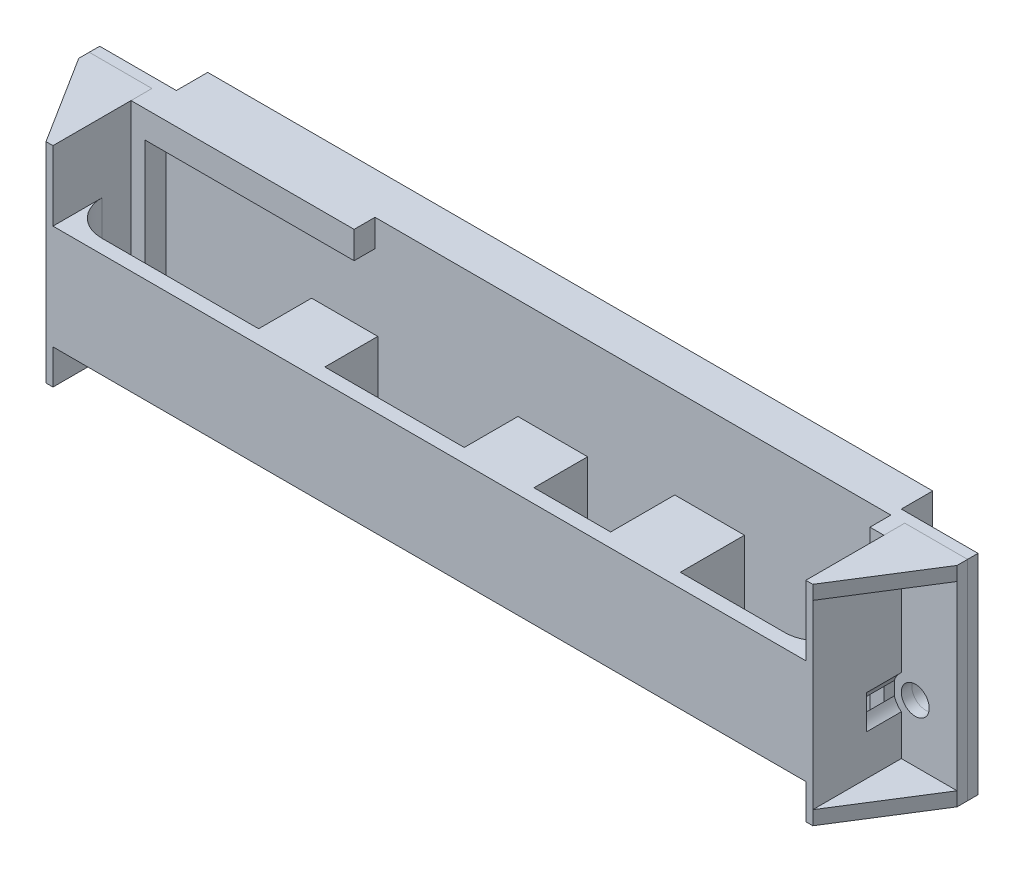
from build123d import *

# Parameters (mm, degrees)
SKETCH1_W             = 30
SKETCH1_H             = 104
BOSS_EXTRUDE1_DEPTH   = 6
BOSS_EXTRUDE2_START   = -6
SKETCH2_W             = 11
SKETCH2_H             = 30
SKETCH2_R             = 2
BOSS_EXTRUDE2_DEPTH   = 1.5
SKETCH4_W             = 2
SKETCH4_H             = 30
BOSS_EXTRUDE5_DEPTH   = 3
SKETCH4_3_W           = 9
SKETCH4_3_H           = 30
SKETCH4_3_R           = 2
BOSS_EXTRUDE6_DEPTH   = 1.5
BOSS_EXTRUDE6_2_DEPTH = 1.5
BOSS_EXTRUDE7_DEPTH   = 2
BOSS_EXTRUDE8_START   = -30
BOSS_EXTRUDE8_DEPTH   = 2
BOSS_EXTRUDE9_REACH   = 74.643
SKETCH5_4_W           = 1
SKETCH5_4_H           = 12.7
BOSS_EXTRUDE10_START  = -5
SKETCH5_5_W           = 9.5
SKETCH5_5_H           = 7.6
SKETCH5_5_W_2         = 10
SKETCH5_5_H_2         = 7.7
SKETCH5_5_H_3         = 9.2
BOSS_EXTRUDE10_DEPTH  = 15
FILLET1_R             = 5
SKETCH6_R             = 3.15
CUT_EXTRUDE3_DEPTH    = 5


with BuildPart() as part:
    # Sketch1 → Boss-Extrude1 (new body)
    with BuildSketch(Plane(origin=(0, 0, 0), x_dir=(0, 1, 0), z_dir=(0, 0, 1))):
        Rectangle(SKETCH1_W, SKETCH1_H)
    extrude(amount=BOSS_EXTRUDE1_DEPTH)

    # Sketch2 → Boss-Extrude2 (add)
    # profile 1 of 2: a face of its own
    with BuildSketch(Plane(origin=(0, 0, 0), x_dir=(1, 0, 0), z_dir=(0, 0, -1)).offset(BOSS_EXTRUDE2_START)):
        with Locations((-57.5, 0)):
            Rectangle(SKETCH2_W, SKETCH2_H)
        with Locations((-57.5, -4.75)):
            Circle(SKETCH2_R, mode=Mode.SUBTRACT)
    # profile 2 of 2: a face of its own
    with BuildSketch(Plane(origin=(0, 0, 0), x_dir=(1, 0, 0), z_dir=(0, 0, -1)).offset(BOSS_EXTRUDE2_START)):
        with Locations((57.5, 0)):
            Rectangle(SKETCH2_W, SKETCH2_H)
        with Locations((57, 4.75)):
            Circle(SKETCH2_R, mode=Mode.SUBTRACT)
    extrude(amount=BOSS_EXTRUDE2_DEPTH)

    # Sketch4 → Boss-Extrude5 (add)
    with BuildSketch(Plane.XY.offset(6)):
        Polygon((-22, 11.1), (-22, 15), (-54, 15), (-54, -15), (-30, -15), (-30, -11.1), (-52, -11.1), (-52, 11.1), align=None)
        with Locations((53, 0)):
            Rectangle(SKETCH4_W, SKETCH4_H)
    extrude(amount=BOSS_EXTRUDE5_DEPTH)


with BuildPart() as body_2:
    # Sketch4<3> → Boss-Extrude6 (new body)
    with BuildSketch(Plane.XY.offset(6)):
        with Locations((-58.5, 0)):
            Rectangle(SKETCH4_3_W, SKETCH4_3_H)
        with Locations((-57.5, 4.75)):
            Circle(SKETCH4_3_R, mode=Mode.SUBTRACT)
    extrude(amount=BOSS_EXTRUDE6_DEPTH)



with BuildPart() as body_3:
    # Sketch4<3> → Boss-Extrude6 2 (new body)
    with BuildSketch(Plane.XY.offset(6)):
        with Locations((58.5, 0)):
            Rectangle(SKETCH4_3_W, SKETCH4_3_H)
        with Locations((57, -4.75)):
            Circle(SKETCH4_3_R, mode=Mode.SUBTRACT)
    extrude(amount=BOSS_EXTRUDE6_2_DEPTH)


with BuildPart() as body_2_1:
    add(body_2.part)

    add(body_3.part)  # Boss-Extrude7 merges body 3
    # Sketch5 → Boss-Extrude7 (add)
    with BuildSketch(Plane.XZ.offset(15)):
        Polygon((-55, 20.2), (-63, 7.5), (-54, 7.5), (-54, 20.2), align=None)
        Polygon((55, 20.2), (54, 20.2), (54, 7.5), (63, 7.5), align=None)
    extrude(amount=-BOSS_EXTRUDE7_DEPTH)

    # Sketch5<3> → Boss-Extrude8 (add)
    with BuildSketch(Plane.XZ.offset(15).offset(BOSS_EXTRUDE8_START)):
        Polygon((-55, 20.2), (-63, 7.5), (-54, 7.5), (-54, 20.2), align=None)
        Polygon((55, 20.2), (54, 20.2), (54, 7.5), (63, 7.5), align=None)
    extrude(amount=BOSS_EXTRUDE8_DEPTH)

    # Boss-Extrude9: up to this face of the body (flat: up to its plane)
    boss_extrude9_end = Plane(body_2_1.part.faces().sort_by_distance((57.29047619, 15, 11.208744589))[0])
    # Sketch5<4> → Boss-Extrude9 (add, up to the picked face)
    with BuildSketch(Plane.XZ.offset(15), mode=Mode.PRIVATE) as boss_extrude9_sk1:
        with Locations((-54.5, 13.85)):
            Rectangle(SKETCH5_4_W, SKETCH5_4_H)
    boss_extrude9_tool1 = split(extrude(boss_extrude9_sk1.sketch, amount=-BOSS_EXTRUDE9_REACH, mode=Mode.PRIVATE), bisect_by=boss_extrude9_end, keep=Keep.BOTH, mode=Mode.PRIVATE)
    # Sketch5<4> → Boss-Extrude9 (add, up to the picked face)
    with BuildSketch(Plane.XZ.offset(15), mode=Mode.PRIVATE) as boss_extrude9_sk2:
        with Locations((54.5, 13.85)):
            Rectangle(SKETCH5_4_W, SKETCH5_4_H)
    boss_extrude9_tool2 = split(extrude(boss_extrude9_sk2.sketch, amount=-BOSS_EXTRUDE9_REACH, mode=Mode.PRIVATE), bisect_by=boss_extrude9_end, keep=Keep.BOTH, mode=Mode.PRIVATE)
    add(boss_extrude9_tool1.solids().sort_by(Axis((-54.5, -15, 13.85), (0, 1, 0)))[0])
    add(boss_extrude9_tool2.solids().sort_by(Axis((54.5, -15, 13.85), (0, 1, 0)))[0])

    # Sketch5<5> → Boss-Extrude10 (add)
    with BuildSketch(Plane.XZ.offset(15).offset(BOSS_EXTRUDE10_START)):
        with Locations((-21.75, 14.4)):
            Rectangle(SKETCH5_5_W, SKETCH5_5_H)
        with Locations((8, 14.35)):
            Rectangle(SKETCH5_5_W_2, SKETCH5_5_H_2)
        with Locations((29, 13.6)):
            Rectangle(SKETCH5_5_W_2, SKETCH5_5_H_3)
        Polygon((54, 20.2), (-54, 20.2), (-54, 18.2), (-26.5, 18.2), (-17, 18.2), (3, 18.2), (13, 18.2), (24, 18.2), (34, 18.2), (54, 18.2), align=None)
    extrude(amount=-BOSS_EXTRUDE10_DEPTH)

    # Fillet1
    fillet1_edges = [body_2_1.edges().sort_by_distance(p)[0] for p in [
        (-54, -2.5, 18.2),
        (54, -2.5, 18.2),
    ]]
    fillet(fillet1_edges, radius=FILLET1_R)

    # Sketch6 → Cut-Extrude3 (cut)
    with BuildSketch(Plane.XY.offset(7.5)):
        with Locations((57, -4.75)):
            Circle(SKETCH6_R)
        with Locations((-57.5, 4.75)):
            Circle(SKETCH6_R)
    extrude(amount=CUT_EXTRUDE3_DEPTH, mode=Mode.SUBTRACT)


solid = Compound([part.part, body_2_1.part])
